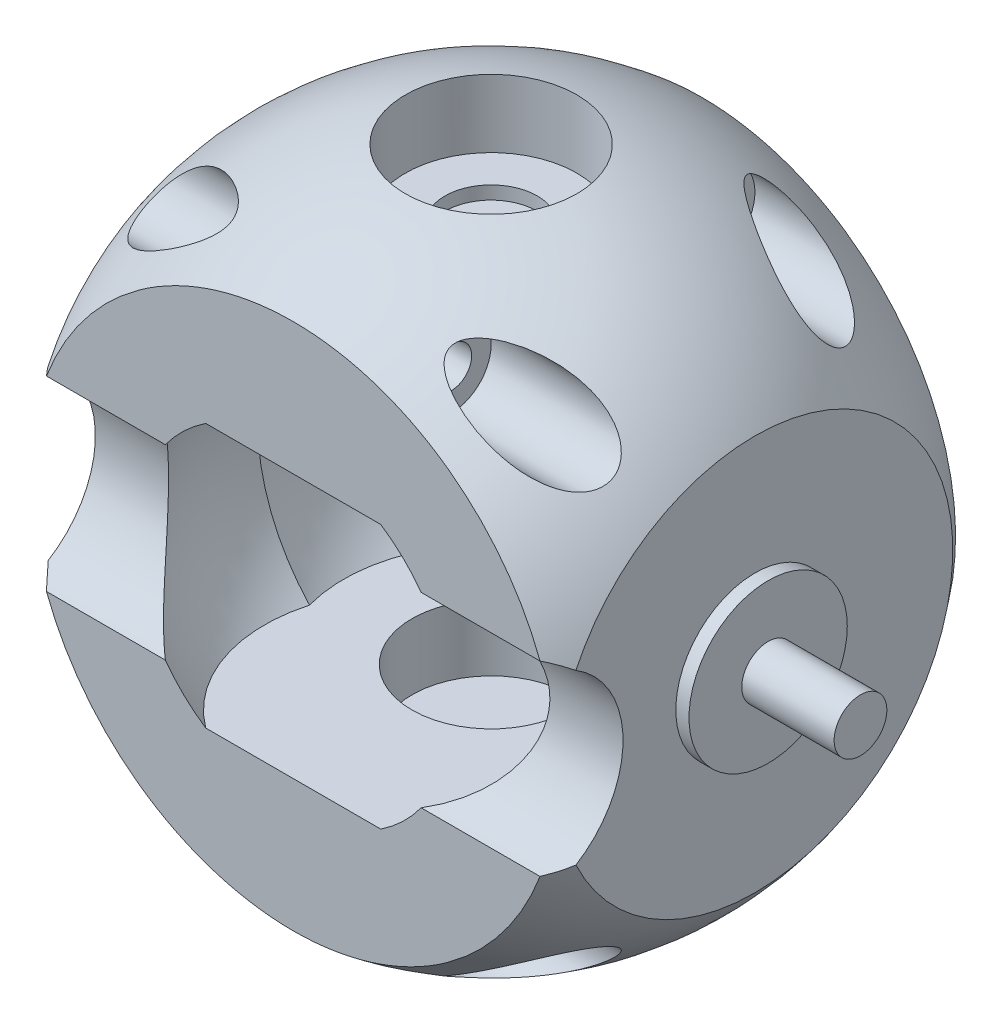
from build123d import *

# Parameters (mm, degrees)
CORTAR_EXTRUIR1_DEPTH      = 20
CORTAR_EXTRUIR1_DEPTH_BACK = 20
CROQUIS2_W                 = 5
CROQUIS2_H                 = 30.016419067
CROQUIS5_R                 = 6
SALIENTE_EXTRUIR1_DEPTH    = 1
CROQUIS7_R                 = 2
SALIENTE_EXTRUIR3_DEPTH    = 7
CORTAR_EXTRUIR2_DEPTH      = 20
CORTAR_EXTRUIR2_DEPTH_BACK = 20
CROQUIS3_W                 = 9
CROQUIS3_H                 = 50
CORTAR_EXTRUIR3_DEPTH      = 15
CORTAR_EXTRUIR3_DEPTH_BACK = 15
CROQUIS8_R                 = 6
CORTAR_EXTRUIR4_DEPTH      = 18
CORTAR_EXTRUIR4_DEPTH_BACK = 18
CROQUIS10_R                = 1.525
CROQUIS14_R                = 3
CORTAR_EXTRUIR5_DEPTH      = 13
CORTAR_EXTRUIR6_START      = -13
CROQUIS15_R                = 3
CORTAR_EXTRUIR6_DEPTH      = 13


with BuildPart() as part:
    # Croquis1 → Revolución1 (revolve)
    with BuildSketch(Plane.XY):
        with BuildLine():
            ThreePointArc((0, -25), (25, 0), (0, 25))
            Line((0, 25), (0, 15))
            Line((0, 15), (0, 10))
            Line((0, 10), (11.180339887, 10))
            ThreePointArc((11.180339887, 10), (15, 0), (11.180339887, -10))
            Line((11.180339887, -10), (0, -10))
            Line((0, -10), (0, -15))
            Line((0, -15), (0, -25))
        make_face()
    revolve(axis=Axis((0, 25, 0), (0, -1, 0)))

    # Croquis2 → Cortar-Extruir1 (cut, two sides: drawn at the far end of the back side and taken through both)
    with BuildSketch(Plane.XY.offset(-CORTAR_EXTRUIR1_DEPTH_BACK)):
        with Locations((22.5, 0.008209533)):
            Rectangle(CROQUIS2_W, CROQUIS2_H)
        with Locations((-22.5, 0.008209533)):
            Rectangle(CROQUIS2_W, CROQUIS2_H)
    extrude(amount=CORTAR_EXTRUIR1_DEPTH + CORTAR_EXTRUIR1_DEPTH_BACK, mode=Mode.SUBTRACT)

    # Croquis4 → Cortar-Revolución1 (revolve, cut)
    with BuildSketch(Plane(origin=(0, 0, 0), x_dir=(0, 0, -1), z_dir=(1, 0, 0))):
        with BuildLine():
            Line((-6, 10), (-6, -10))
            Line((-6, -10), (5.180339887, -10))
            ThreePointArc((5.180339887, -10), (9, 0), (5.180339887, 10))
            Line((5.180339887, 10), (-6, 10))
        make_face()
    revolve(axis=Axis((0, 10, 6), (0, -1, 0)), mode=Mode.SUBTRACT)

    # Croquis5 → Saliente-Extruir1 (add)
    with BuildSketch(Plane(origin=(20, 0, 0), x_dir=(0, 0, -1), z_dir=(1, 0, 0))):
        Circle(CROQUIS5_R)
    saliente_extruir1 = extrude(amount=SALIENTE_EXTRUIR1_DEPTH)

    # Simetría3: Saliente-Extruir1 across plane
    add(saliente_extruir1.mirror(Plane(origin=(0, 0, 0), x_dir=(0, 0, 1), z_dir=(1, 0, 0))))

    # Croquis7 → Saliente-Extruir3 (add)
    with BuildSketch(Plane(origin=(21, 0, 0), x_dir=(0, 0, -1), z_dir=(1, 0, 0))):
        Circle(CROQUIS7_R)
    saliente_extruir3 = extrude(amount=SALIENTE_EXTRUIR3_DEPTH)

    # Simetría4: Saliente-Extruir3 across plane
    add(saliente_extruir3.mirror(Plane(origin=(0, 0, 0), x_dir=(0, 0, 1), z_dir=(1, 0, 0))))

    # Croquis3 → Cortar-Extruir2 (cut, two sides: drawn at the far end of the back side and taken through both)
    with BuildSketch(Plane(origin=(0, 0, 0), x_dir=(0, 0, -1), z_dir=(1, 0, 0)).offset(-CORTAR_EXTRUIR2_DEPTH_BACK)):
        with BuildLine():
            Line((-15, 7.071067812), (-15, 25))
            Line((-15, 25), (-25, 25))
            Line((-25, 25), (-25, -25))
            Line((-25, -25), (-15, -25))
            Line((-15, -25), (-15, -7.071067812))
            ThreePointArc((-15, -7.071067812), (-10, 0), (-15, 7.071067812))
        make_face()
        with Locations((20.5, 0)):
            Rectangle(CROQUIS3_W, CROQUIS3_H)
    extrude(amount=CORTAR_EXTRUIR2_DEPTH + CORTAR_EXTRUIR2_DEPTH_BACK, mode=Mode.SUBTRACT)

    # Croquis8 → Cortar-Extruir3 (cut, two sides: drawn at the far end of the back side and taken through both)
    with BuildSketch(Plane(origin=(0, 0, 0), x_dir=(1, 0, 0), z_dir=(0, 1, 0)).offset(-CORTAR_EXTRUIR3_DEPTH_BACK)):
        Circle(CROQUIS8_R)
    extrude(amount=CORTAR_EXTRUIR3_DEPTH + CORTAR_EXTRUIR3_DEPTH_BACK, mode=Mode.SUBTRACT)

    # Croquis9 → Cortar-Revolución2 (revolve, cut)
    with BuildSketch(Plane.ZY):
        Polygon((-2.003, 15), (0, 15), (0, 25), (-6.5, 25), (-6.5, 19), (-3.503, 19), (-3.503, 18), (-2.003, 18), align=None)
    revolve(axis=Axis((0, 15, 0), (0, 1, 0)), mode=Mode.SUBTRACT)

    # Croquis10 → Cortar-Extruir4 (cut, two sides: drawn at the far end of the back side and taken through both)
    with BuildSketch(Plane(origin=(0, 0, 0), x_dir=(0, 0, -1), z_dir=(1, 0, 0)).offset(-CORTAR_EXTRUIR4_DEPTH_BACK)):
        with Locations((-10, 18)):
            Circle(CROQUIS10_R)
        with Locations((10, 18)):
            Circle(CROQUIS10_R)
        with Locations((10, -18)):
            Circle(CROQUIS10_R)
        with Locations((-10, -18)):
            Circle(CROQUIS10_R)
    extrude(amount=CORTAR_EXTRUIR4_DEPTH + CORTAR_EXTRUIR4_DEPTH_BACK, mode=Mode.SUBTRACT)

    # Croquis14 → Cortar-Extruir5 (cut)
    with BuildSketch(Plane.ZY.offset(20)):
        with Locations((-10, 18)):
            Circle(CROQUIS14_R)
        with Locations((10, 18)):
            Circle(CROQUIS14_R)
        with Locations((10, -18)):
            Circle(CROQUIS14_R)
        with Locations((-10, -18)):
            Circle(CROQUIS14_R)
    extrude(amount=-CORTAR_EXTRUIR5_DEPTH, mode=Mode.SUBTRACT)

    # Croquis15 → Cortar-Extruir6 (cut)
    with BuildSketch(Plane(origin=(20, 0, 0), x_dir=(0, 0, -1), z_dir=(1, 0, 0)).offset(CORTAR_EXTRUIR6_START)):
        with Locations((-10, 18)):
            Circle(CROQUIS15_R)
        with Locations((10, 18)):
            Circle(CROQUIS15_R)
        with Locations((10, -18)):
            Circle(CROQUIS15_R)
        with Locations((-10, -18)):
            Circle(CROQUIS15_R)
    extrude(amount=CORTAR_EXTRUIR6_DEPTH, mode=Mode.SUBTRACT)


solid = part.part
